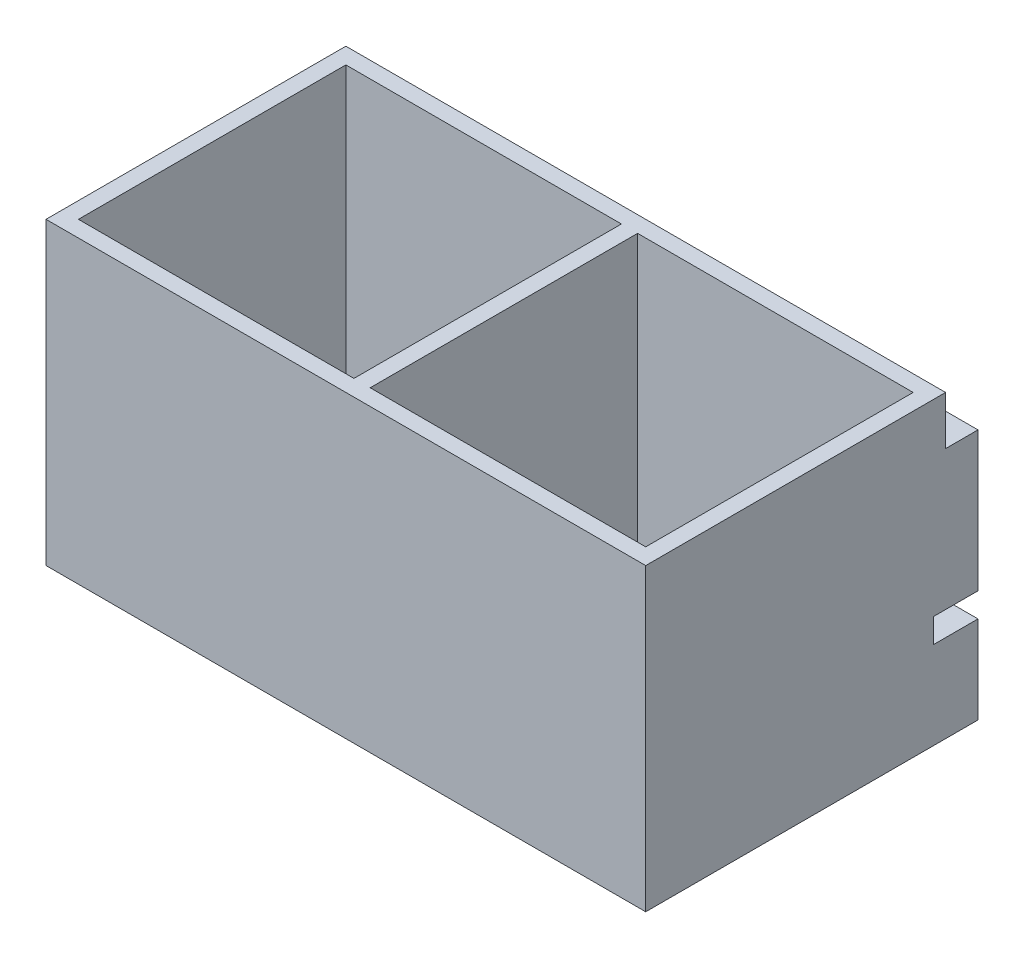
from build123d import *

# Parameters (mm, degrees)
SKETCH1_W           = 74
SKETCH1_H           = 37
BOSS_EXTRUDE1_DEPTH = 37
SKETCH3_W           = 34
SKETCH3_H           = 33
CUT_EXTRUDE1_DEPTH  = 35
SKETCH5_R           = 13
CUT_EXTRUDE2_DEPTH  = 3.5
SKETCH6_W           = 74
SKETCH6_H           = 31
BOSS_EXTRUDE2_DEPTH = 4
CUT_EXTRUDE3_DEPTH  = 5.5


with BuildPart() as part:
    # Sketch1 → Boss-Extrude1 (new body)
    with BuildSketch(Plane(origin=(0, 0, 0), x_dir=(1, 0, 0), z_dir=(0, 1, 0))):
        with Locations((-33.6, -17.484146341)):
            Rectangle(SKETCH1_W, SKETCH1_H)
    extrude(amount=BOSS_EXTRUDE1_DEPTH)

    # Sketch3 → Cut-Extrude1 (cut)
    with BuildSketch(Plane(origin=(0, 37, 0), x_dir=(1, 0, 0), z_dir=(0, 1, 0))):
        with Locations((-51.6, -17.484146341)):
            Rectangle(SKETCH3_W, SKETCH3_H)
        with Locations((-15.6, -17.484146341)):
            Rectangle(SKETCH3_W, SKETCH3_H)
    extrude(amount=-CUT_EXTRUDE1_DEPTH, mode=Mode.SUBTRACT)

    # Sketch5 → Cut-Extrude2 (cut)
    with BuildSketch(Plane(origin=(0, 2, 0), x_dir=(1, 0, 0), z_dir=(0, 1, 0))):
        with Locations(Location((-15.1, -17.484146341, 0), (0, 0, 270))):
            Circle(SKETCH5_R)
        with Locations(Location((-52.1, -17.484146341, 0), (0, 0, 270))):
            Circle(SKETCH5_R)
    extrude(amount=-CUT_EXTRUDE2_DEPTH, mode=Mode.SUBTRACT)

    # Sketch6 → Boss-Extrude2 (add)
    with BuildSketch(Plane(origin=(0, 0, -1.015853659), x_dir=(-1, 0, 0), z_dir=(0, 0, -1))):
        with Locations((33.6, 15.5)):
            Rectangle(SKETCH6_W, SKETCH6_H)
    extrude(amount=BOSS_EXTRUDE2_DEPTH)

    # Sketch8 → Cut-Extrude3 (cut)
    with BuildSketch(Plane(origin=(0, 0, -5.015853659), x_dir=(-1, 0, 0), z_dir=(0, 0, -1))):
        Polygon((4.6, 29), (28.6, 29), (28.6, 13.8), (38.6, 13.8), (38.6, 29), (62.6, 29), (62.6, 13.8), (70.6, 13.8), (70.6, 10.8), (62.6, 10.8), (62.6, 0), (38.6, 0), (38.6, 10.8), (28.6, 10.8), (28.6, 0), (4.6, 0), (4.6, 10.8), (-3.4, 10.8), (-3.4, 13.8), (4.6, 13.8), align=None)
    extrude(amount=-CUT_EXTRUDE3_DEPTH, mode=Mode.SUBTRACT)


solid = part.part
